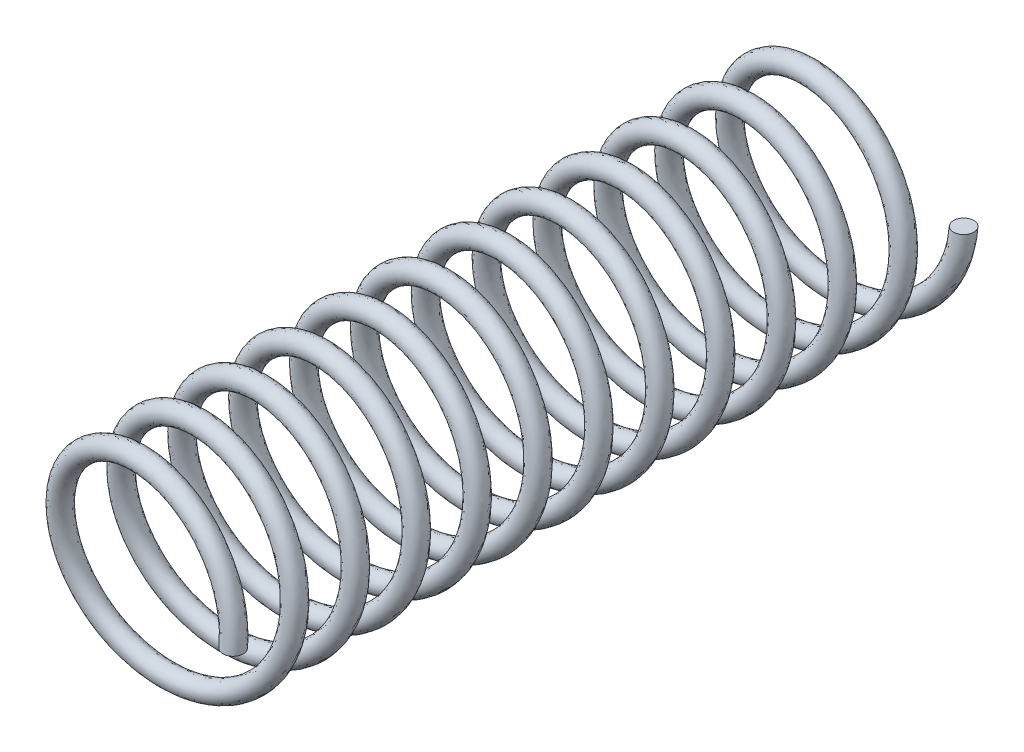
from build123d import *

# Parameters (mm, degrees)
SWEEP_1_PITCH  = 3
SWEEP_1_HEIGHT = 36
SWEEP_1_RADIUS = 5
SKETCH_6_R     = 0.5


with BuildPart() as part:
    # 掃出1: sweep along a helix
    with BuildLine() as sweep_1_path:
        Helix(SWEEP_1_PITCH, SWEEP_1_HEIGHT, SWEEP_1_RADIUS, center=(0, 0, 0), direction=(0, 0, 1), lefthand=True)
    # 草圖6 → 掃出1 (sweep)
    with BuildSketch(Plane(origin=(0, 0, 0), x_dir=(1, 0, 0), z_dir=(0, 1, 0))):
        with Locations((5, 0)):
            Circle(SKETCH_6_R)
    sweep(path=sweep_1_path.line, is_frenet=True)


solid = part.part
